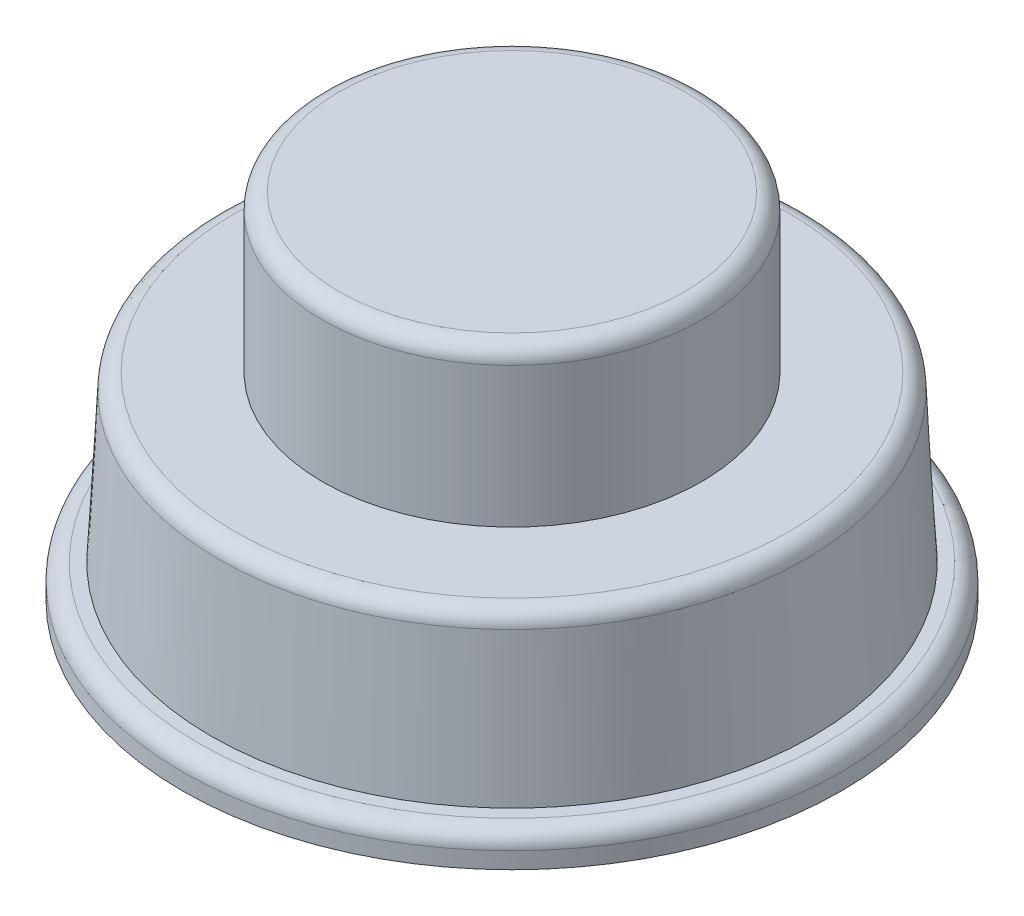
from build123d import *

# Parameters (mm, degrees)
SKETCH1_R           = 20
BOSS_EXTRUDE1_DEPTH = 2
SKETCH2_R           = 18.25
BOSS_EXTRUDE2_DEPTH = 10
BOSS_EXTRUDE2_TAPER = 3
SKETCH3_R           = 11.5
BOSS_EXTRUDE3_DEPTH = 9.5
FILLET1_R           = 1


with BuildPart() as part:
    # Sketch1 → Boss-Extrude1 (new body)
    with BuildSketch(Plane(origin=(0, 0, 0), x_dir=(1, 0, 0), z_dir=(0, 1, 0))):
        with Locations(Location((0, 0, 0), (0, 0, 270))):
            Circle(SKETCH1_R)
    extrude(amount=BOSS_EXTRUDE1_DEPTH)

    # Sketch2 → Boss-Extrude2 (add)
    with BuildSketch(Plane(origin=(0, 2, 0), x_dir=(1, 0, 0), z_dir=(0, 1, 0))):
        Circle(SKETCH2_R)
    extrude(amount=BOSS_EXTRUDE2_DEPTH, taper=BOSS_EXTRUDE2_TAPER)

    # Sketch3 → Boss-Extrude3 (add)
    with BuildSketch(Plane(origin=(0, 12, 0), x_dir=(1, 0, 0), z_dir=(0, 1, 0))):
        with Locations(Location((0, 0, 0), (0, 0, 270))):
            Circle(SKETCH3_R)
    extrude(amount=BOSS_EXTRUDE3_DEPTH)

    # Fillet1
    fillet1_edges = [part.edges().sort_by_distance(p)[0] for p in [
        (0, 21.5, -11.5),
        (0, 2, -20),
        (-17.725922207, 12, 0),
    ]]
    fillet(fillet1_edges, radius=FILLET1_R)


solid = part.part
